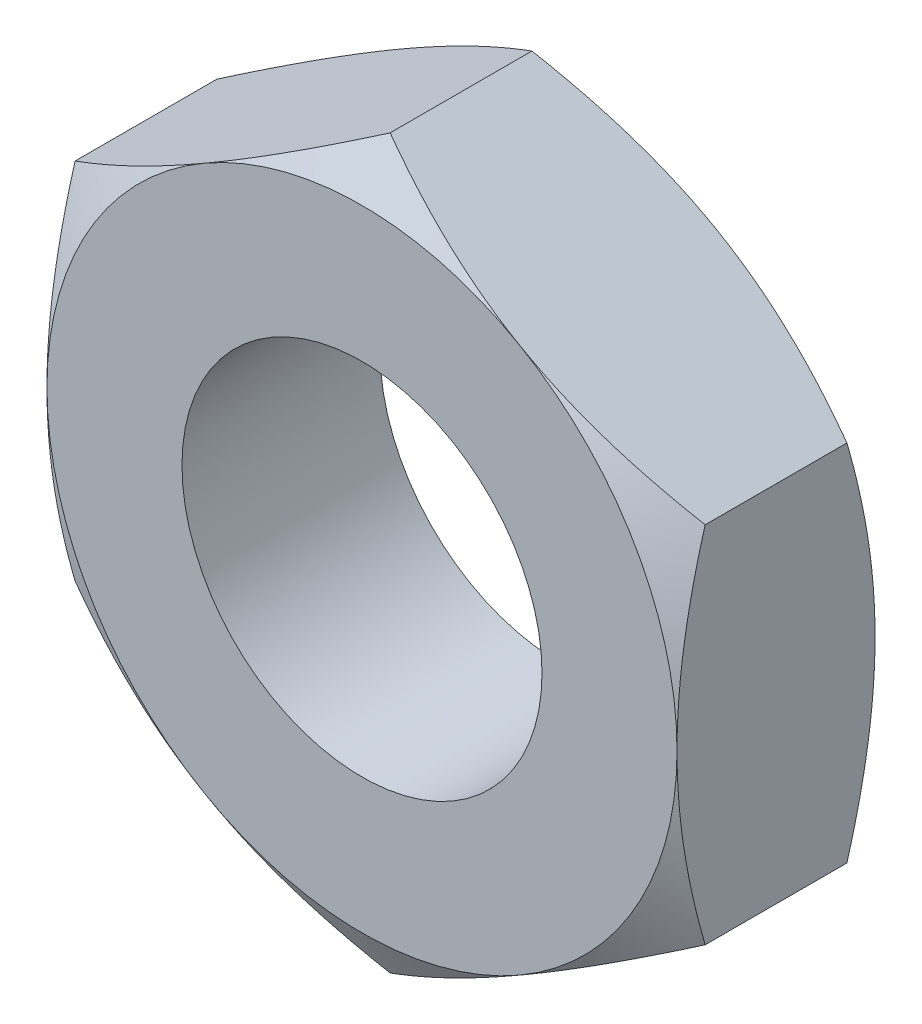
from build123d import *

# Parameters (mm, degrees)
SZKIC1_R                    = 2
DODANIE_WYCI_GNI_CIE1_DEPTH = 1.1
SZKIC2_OUTSIDE_W            = 18.804
SZKIC2_OUTSIDE_H            = 19.886
SZKIC2_OUTSIDE_R            = 3.5
WYTNIJ_WYCI_GNI_CIE2_DEPTH  = 2.2
WYTNIJ_WYCI_GNI_CIE2_DRAFT  = -60
LUSTRO1_COPY_1_SKETCH_W     = 18.804
LUSTRO1_COPY_1_SKETCH_H     = 19.886
LUSTRO1_COPY_1_SKETCH_R     = 3.5
LUSTRO1_COPY_1_DEPTH        = 2.2
LUSTRO1_COPY_1_DRAFT        = -60


with BuildPart() as part:
    # Szkic1 → Dodanie-wyciągnięcie1 (new, symmetric)
    with BuildSketch(Plane.XY):
        Polygon((-3.5, 2.020725942), (-3.5, -2.020725942), (0, -4.041451884), (3.5, -2.020725942), (3.5, 2.020725942), (0, 4.041451884), align=None)
        Circle(SZKIC1_R, mode=Mode.SUBTRACT)
    extrude(amount=DODANIE_WYCI_GNI_CIE1_DEPTH, both=True)


with BuildPart() as wytnij_wyci_gni_cie2_tool:
    # Szkic2 outside → Wytnij-wyciągnięcie2 (with draft: the straight prism first)
    with BuildSketch(Plane.XY.offset(1.1)):
        Rectangle(SZKIC2_OUTSIDE_W, SZKIC2_OUTSIDE_H)
        Circle(SZKIC2_OUTSIDE_R, mode=Mode.SUBTRACT)
    extrude(amount=-WYTNIJ_WYCI_GNI_CIE2_DEPTH)
    # Wytnij-wyciągnięcie2: the draft: its side faces are tilted about the plane it starts from
    wytnij_wyci_gni_cie2_sides = [wytnij_wyci_gni_cie2_tool.faces().sort_by_distance(p)[0] for p in [
        (0, -9.943, 0),
        (9.402, 0, 0),
        (0, 9.943, 0),
        (-9.402, 0, 0),
        (-3.5, 0, 0),
    ]]
    draft(wytnij_wyci_gni_cie2_sides, Plane.XY.offset(1.1), WYTNIJ_WYCI_GNI_CIE2_DRAFT)


with BuildPart() as part_1:
    add(part.part)

    # Wytnij-wyciągnięcie2: cut by wytnij_wyci_gni_cie2_tool
    add(wytnij_wyci_gni_cie2_tool.part, mode=Mode.SUBTRACT)


with BuildPart() as lustro1_copy_1_tool:
    # Lustro1 copy 1 sketch → Lustro1 copy 1 (with draft: the straight prism first)
    with BuildSketch(Plane(origin=(0, 0, -1.1), x_dir=(1, 0, 0), z_dir=(0, 0, -1))):
        Rectangle(LUSTRO1_COPY_1_SKETCH_W, LUSTRO1_COPY_1_SKETCH_H)
        Circle(LUSTRO1_COPY_1_SKETCH_R, mode=Mode.SUBTRACT)
    extrude(amount=-LUSTRO1_COPY_1_DEPTH)
    # Lustro1 copy 1: the draft: its side faces are tilted about the plane it starts from
    lustro1_copy_1_sides = [lustro1_copy_1_tool.faces().sort_by_distance(p)[0] for p in [
        (0, -9.943, 0),
        (9.402, 0, 0),
        (0, 9.943, 0),
        (-9.402, 0, 0),
        (-3.5, 0, 0),
    ]]
    draft(lustro1_copy_1_sides, Plane(origin=(0, 0, -1.1), x_dir=(1, 0, 0), z_dir=(0, 0, -1)), LUSTRO1_COPY_1_DRAFT)


with BuildPart() as part_2:
    add(part_1.part)

    # Lustro1 copy 1: cut by lustro1_copy_1_tool
    add(lustro1_copy_1_tool.part, mode=Mode.SUBTRACT)


solid = part_2.part
